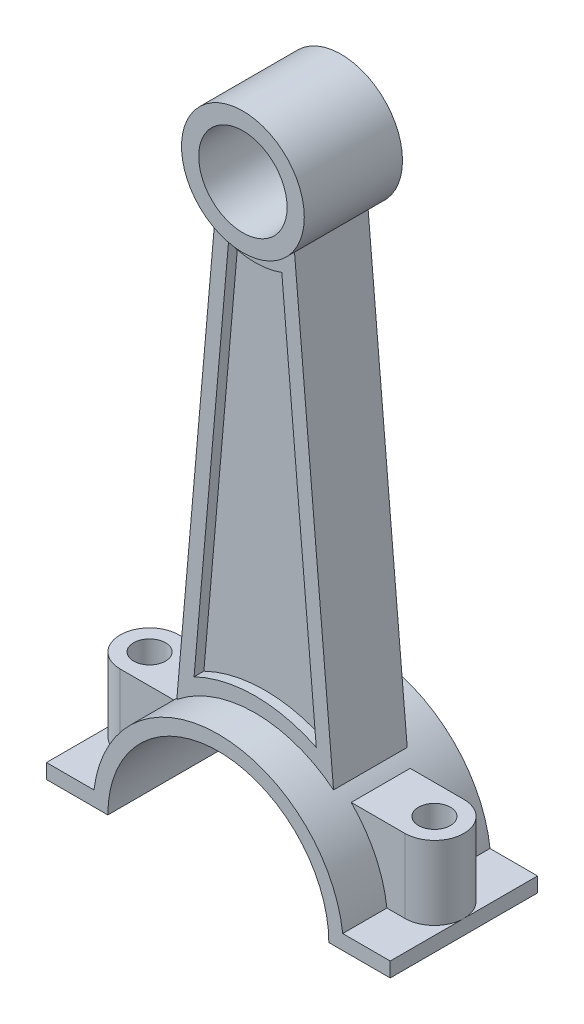
from build123d import *

# Parameters (mm, degrees)
BOSS_EXTRUDE1_DEPTH = 15
BOSS_EXTRUDE2_REACH = 44.119
SKETCH4_R           = 3.25
CUT_EXTRUDE1_DEPTH  = 43.118879377
BOSS_EXTRUDE3_DEPTH = 7.5
CUT_EXTRUDE2_DEPTH  = 2
SKETCH9_R           = 12.5
SKETCH9_R_2         = 9
BOSS_EXTRUDE4_DEPTH = 10


with BuildPart() as part:
    # Sketch1 → Boss-Extrude1 (new, symmetric)
    with BuildSketch(Plane.XY):
        with BuildLine():
            Line((-22.5, 0), (-35, 0))
            Line((-35, 0), (-35, 3))
            Line((-35, 3), (-25.322914524, 3))
            ThreePointArc((-25.322914524, 3), (0, 25.5), (25.322914524, 3))
            Line((25.322914524, 3), (35, 3))
            Line((35, 3), (35, 0))
            Line((35, 0), (22.5, 0))
            ThreePointArc((22.5, 0), (0, 22.5), (-22.5, 0))
        make_face()
    extrude(amount=BOSS_EXTRUDE1_DEPTH, both=True)

    # Sketch3 → Boss-Extrude2 (add, up to next)
    with BuildSketch(Plane(origin=(0, 18, 0), x_dir=(1, 0, 0), z_dir=(0, 1, 0)), mode=Mode.PRIVATE) as boss_extrude2_sk1:
        with BuildLine():
            Line((-18.06, 6), (-18.06, -6))
            Line((-18.06, -6), (-29, -6))
            ThreePointArc((-29, -6), (-35, 0), (-29, 6))
            Line((-29, 6), (-18.06, 6))
        make_face()
    boss_extrude2_tool1 = extrude(boss_extrude2_sk1.sketch, amount=-BOSS_EXTRUDE2_REACH, mode=Mode.PRIVATE) - part.part
    boss_extrude2 = boss_extrude2_tool1.solids().sort_by_distance((-25.943483, 18, 0))[0]
    add(boss_extrude2)

    # Sketch4 → Cut-Extrude1 (cut, through all)
    with BuildSketch(Plane(origin=(0, 18, 0), x_dir=(1, 0, 0), z_dir=(0, 1, 0))):
        with Locations(Location((-29, 0, 0), (0, 0, 180))):
            Circle(SKETCH4_R)
    cut_extrude1 = extrude(amount=-CUT_EXTRUDE1_DEPTH, mode=Mode.SUBTRACT)

    # Mirror1: Boss-Extrude2, Cut-Extrude1 across plane
    add(boss_extrude2.mirror(Plane(origin=(0, 0, 0), x_dir=(0, 0, 1), z_dir=(1, 0, 0))))
    add(cut_extrude1.mirror(Plane(origin=(0, 0, 0), x_dir=(0, 0, 1), z_dir=(1, 0, 0))), mode=Mode.SUBTRACT)

    # Sketch6 → Boss-Extrude3 (add, symmetric)
    with BuildSketch(Plane.XY):
        with BuildLine():
            Line((15.957377604, 19.89), (8.003783203, 110.8))
            ThreePointArc((8.003783203, 110.8), (0, 107.901533963), (-8.003783203, 110.8))
            Line((-8.003783203, 110.8), (-15.957377604, 19.89))
            ThreePointArc((-15.957377604, 19.89), (0, 25.5), (15.957377604, 19.89))
        make_face()
    extrude(amount=BOSS_EXTRUDE3_DEPTH, both=True)

    # Sketch7 → Cut-Extrude2 (cut)
    with BuildSketch(Plane.XY.offset(7.5)):
        with BuildLine():
            Line((-5.422676431, 105.881045668), (-12.442830342, 25.640319286))
            ThreePointArc((-12.442830342, 25.640319286), (0, 28.5), (12.442830342, 25.640319286))
            Line((12.442830342, 25.640319286), (5.422676431, 105.881045668))
            ThreePointArc((5.422676431, 105.881045668), (0, 104.901533963), (-5.422676431, 105.881045668))
        make_face()
    cut_extrude2 = extrude(amount=-CUT_EXTRUDE2_DEPTH, mode=Mode.SUBTRACT)

    # Mirror2: Cut-Extrude2 across plane
    add(cut_extrude2.mirror(Plane.XY), mode=Mode.SUBTRACT)

    # Sketch9 → Boss-Extrude4 (add, symmetric)
    with BuildSketch(Plane.XY):
        with Locations((0, 120.401533963)):
            Circle(SKETCH9_R)
        with Locations((0, 120.401533963)):
            Circle(SKETCH9_R_2, mode=Mode.SUBTRACT)
    extrude(amount=BOSS_EXTRUDE4_DEPTH, both=True)


solid = part.part
